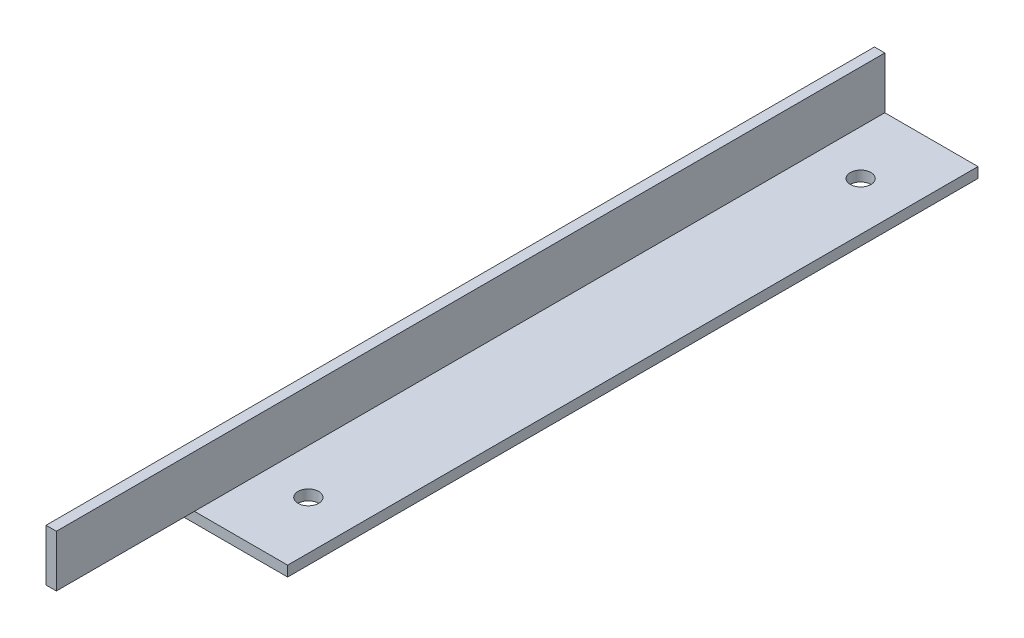
from build123d import *

# Parameters (mm, degrees)
EXTRUSION1_DEPTH = 100
ESQUISSE2_R      = 1.5
EXTRUSION2_DEPTH = 120
ESQUISSE3_W      = 1.5
ESQUISSE3_H      = 7.5
EXTRUSION3_DEPTH = 20


with BuildPart() as part:
    # Esquisse1 → Extrusion1 (new body)
    with BuildSketch(Plane.XY):
        Polygon((-18.340739011, -0.545052632), (-18.340739011, -9.545052632), (-3.340739011, -9.545052632), (-3.340739011, -8.045052632), (-16.840739011, -8.045052632), (-16.840739011, -0.545052632), align=None)
    extrude(amount=EXTRUSION1_DEPTH)

    # Esquisse2 → Extrusion2 (cut)
    with BuildSketch(Plane(origin=(0, -8.045052632, 0), x_dir=(-1, 0, 0), z_dir=(0, 1, 0))):
        with Locations((10.340739011, 90)):
            Circle(ESQUISSE2_R)
        with Locations((10.340739011, 10)):
            Circle(ESQUISSE2_R)
    extrude(amount=-EXTRUSION2_DEPTH, mode=Mode.SUBTRACT)

    # Esquisse3 → Extrusion3 (add)
    with BuildSketch(Plane.XY.offset(100)):
        with Locations((-17.590739011, -4.295052632)):
            Rectangle(ESQUISSE3_W, ESQUISSE3_H)
    extrude(amount=EXTRUSION3_DEPTH)


solid = part.part
